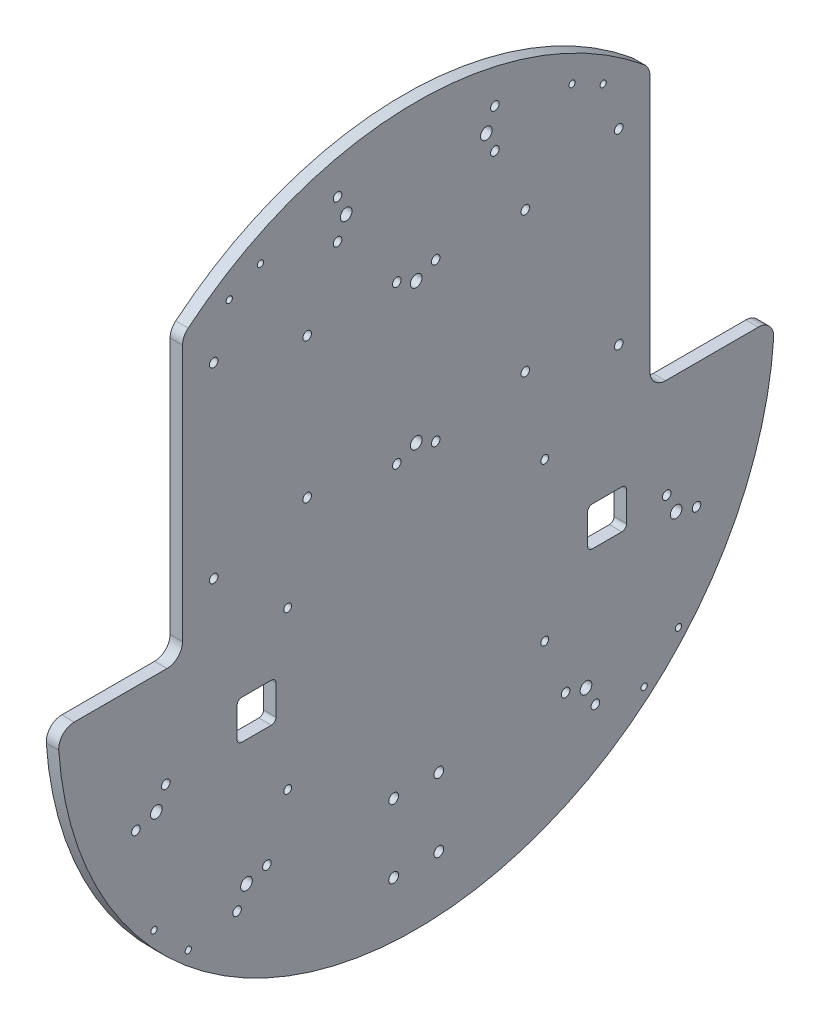
from build123d import *

# Parameters (mm, degrees)
SKETCH_1_R           = 230
EXTRUDE_1_DEPTH      = 8
SKETCH_2_W           = 80
SKETCH_2_H           = 200
CUT_EXTRUDE_1_DEPTH  = 12
SKETCH_3_R           = 2.75
CUT_EXTRUDE_2_DEPTH  = 12
SKETCH_4_R           = 3.15
CUT_EXTRUDE_3_DEPTH  = 12
SKETCH_5_R           = 3.75
SKETCH_5_R_2         = 2.75
CUT_EXTRUDE_4_DEPTH  = 10
FILLET_1_R           = 10
SKETCH_6_W           = 25
SKETCH_6_H           = 25
CUT_EXTRUDE_5_DEPTH  = 10
SKETCH_7_R           = 2.5
CUT_EXTRUDE_6_DEPTH  = 10
SKETCH_8_W           = 25
SKETCH_8_H           = 25
CUT_EXTRUDE_7_DEPTH  = 10
FILLET_3_R           = 3
SKETCH_10_R          = 2
CUT_EXTRUDE_9_DEPTH  = 326.005785815
SKETCH_11_R          = 2
CUT_EXTRUDE_10_DEPTH = 25
FILLET_4_R           = 3


with BuildPart() as part:
    # 草图1 → 凸台-拉伸1 (new body)
    with BuildSketch(Plane(origin=(0, 0, 0), x_dir=(0, 0, -1), z_dir=(1, 0, 0))):
        Circle(SKETCH_1_R)
    extrude(amount=EXTRUDE_1_DEPTH)

    # 草图2 → 切除-拉伸1 (cut)
    with BuildSketch(Plane(origin=(8, 0, 0), x_dir=(0, 0, -1), z_dir=(1, 0, 0))):
        with Locations((-190, 95)):
            Rectangle(SKETCH_2_W, SKETCH_2_H)
        with Locations((190, 95)):
            Rectangle(SKETCH_2_W, SKETCH_2_H)
    extrude(amount=-CUT_EXTRUDE_1_DEPTH, mode=Mode.SUBTRACT)

    # 草图3 → 切除-拉伸2 (cut)
    with BuildSketch(Plane(origin=(8, 0, 0), x_dir=(0, 0, -1), z_dir=(1, 0, 0))):
        with Locations((-130, 150)):
            Circle(SKETCH_3_R)
        with Locations((-130, 30)):
            Circle(SKETCH_3_R)
        with Locations((130, 30)):
            Circle(SKETCH_3_R)
        with Locations((130, 150)):
            Circle(SKETCH_3_R)
        with Locations((-70, 135)):
            Circle(SKETCH_3_R)
        with Locations((-70, 45)):
            Circle(SKETCH_3_R)
        with Locations((70, 135)):
            Circle(SKETCH_3_R)
        with Locations((70, 45)):
            Circle(SKETCH_3_R)
    extrude(amount=-CUT_EXTRUDE_2_DEPTH, mode=Mode.SUBTRACT)

    # 草图4 → 切除-拉伸3 (cut)
    with BuildSketch(Plane(origin=(8, 0, 0), x_dir=(0, 0, -1), z_dir=(1, 0, 0))):
        with Locations((-14.5, -150)):
            Circle(SKETCH_4_R)
        with Locations((14.5, -150)):
            Circle(SKETCH_4_R)
        with Locations((14.5, -194)):
            Circle(SKETCH_4_R)
        with Locations((-14.5, -194)):
            Circle(SKETCH_4_R)
    extrude(amount=-CUT_EXTRUDE_3_DEPTH, mode=Mode.SUBTRACT)

    # 草图5 → 切除-拉伸4 (cut)
    with BuildSketch(Plane(origin=(8, 0, 0), x_dir=(0, 0, -1), z_dir=(1, 0, 0))):
        with Locations((166.813442197, -81.229769803)):
            Circle(SKETCH_5_R)
        with Locations((108.962557326, -150.173769684)):
            Circle(SKETCH_5_R)
        with Locations((-108.962557326, -150.173769684)):
            Circle(SKETCH_5_R)
        with Locations((-166.813442197, -81.229769803)):
            Circle(SKETCH_5_R)
        with Locations((-45, 190)):
            Circle(SKETCH_5_R)
        with Locations((45, 190)):
            Circle(SKETCH_5_R)
        with Locations((-12.5, 35)):
            Circle(SKETCH_5_R_2)
        with Locations((12.5, 35)):
            Circle(SKETCH_5_R_2)
        with Locations((95.851669933, -146.352169)):
            Circle(SKETCH_5_R_2)
        with Locations((160.773218512, -68.981680245)):
            Circle(SKETCH_5_R_2)
        with Locations((179.92432959, -85.051370487)):
            Circle(SKETCH_5_R_2)
        with Locations((115.002781011, -162.421859242)):
            Circle(SKETCH_5_R_2)
        with Locations((-179.92432959, -85.051370487)):
            Circle(SKETCH_5_R_2)
        with Locations((-160.773218512, -68.981680245)):
            Circle(SKETCH_5_R_2)
        with Locations((-95.851669933, -146.352169)):
            Circle(SKETCH_5_R_2)
        with Locations((-115.002781011, -162.421859242)):
            Circle(SKETCH_5_R_2)
        with Locations((50.5, 202.5)):
            Circle(SKETCH_5_R_2)
        with Locations((-50.5, 202.5)):
            Circle(SKETCH_5_R_2)
        with Locations((50.5, 177.5)):
            Circle(SKETCH_5_R_2)
        with Locations((-50.5, 177.5)):
            Circle(SKETCH_5_R_2)
        with Locations((12.5, 136)):
            Circle(SKETCH_5_R_2)
        with Locations((-12.5, 136)):
            Circle(SKETCH_5_R_2)
        with Locations((0, 130.5)):
            Circle(SKETCH_5_R)
        with Locations((0, 40.5)):
            Circle(SKETCH_5_R)
    extrude(amount=-CUT_EXTRUDE_4_DEPTH, mode=Mode.SUBTRACT)

    # 圆角1
    fillet_1_edges = [part.edges().sort_by_distance(p)[0] for p in [
        (4, 174.355957742, -150),
        (4, -5, -150),
        (4, -5, -229.945645751),
        (4, 174.355957742, 150),
        (4, -5, 229.945645751),
        (4, -5, 150),
    ]]
    fillet(fillet_1_edges, radius=FILLET_1_R)

    # 草图6 → 切除-拉伸5 (cut)
    with BuildSketch(Plane(origin=(8, 0, 0), x_dir=(0, 0, -1), z_dir=(1, 0, 0))):
        with Locations((-102.5, -57.5)):
            Rectangle(SKETCH_6_W, SKETCH_6_H)
    extrude(amount=-CUT_EXTRUDE_5_DEPTH, mode=Mode.SUBTRACT)

    # 草图7 → 切除-拉伸6 (cut)
    with BuildSketch(Plane(origin=(8, 0, 0), x_dir=(0, 0, -1), z_dir=(1, 0, 0))):
        with Locations((82.5, -10)):
            Circle(SKETCH_7_R)
        with Locations((82.5, -111)):
            Circle(SKETCH_7_R)
        with Locations((-82.5, -10)):
            Circle(SKETCH_7_R)
        with Locations((-82.5, -111)):
            Circle(SKETCH_7_R)
    extrude(amount=-CUT_EXTRUDE_6_DEPTH, mode=Mode.SUBTRACT)

    # 草图8 → 切除-拉伸7 (cut)
    with BuildSketch(Plane(origin=(8, 0, 0), x_dir=(0, 0, -1), z_dir=(1, 0, 0))):
        with Locations((122.5, -62.5)):
            Rectangle(SKETCH_8_W, SKETCH_8_H)
    extrude(amount=-CUT_EXTRUDE_7_DEPTH, mode=Mode.SUBTRACT)

    # 圆角3
    fillet_3_edges = [part.edges().sort_by_distance(p)[0] for p in [
        (4, -75, -110),
        (4, -50, -110),
        (4, -50, -135),
        (4, -75, -135),
    ]]
    fillet(fillet_3_edges, radius=FILLET_3_R)

    # 草图10 → 切除-拉伸9 (cut, through all)
    with BuildSketch(Plane(origin=(8, 0, 0), x_dir=(0, 0, -1), z_dir=(1, 0, 0))):
        with Locations((168.30023639, -146.301163465)):
            Circle(SKETCH_10_R)
        with Locations((146.301163465, -168.30023639)):
            Circle(SKETCH_10_R)
        with Locations(Location((-146.301163465, -168.30023639, 0), (0, 0, 180))):
            Circle(SKETCH_10_R)
        with Locations(Location((-168.30023639, -146.301163465, 0), (0, 0, 180))):
            Circle(SKETCH_10_R)
    extrude(amount=-CUT_EXTRUDE_9_DEPTH, mode=Mode.SUBTRACT)

    # 草图11 → 切除-拉伸10 (cut)
    with BuildSketch(Plane(origin=(8, 0, 0), x_dir=(0, 0, -1), z_dir=(1, 0, 0))):
        with Locations((100, 190)):
            Circle(SKETCH_11_R)
        with Locations((120, 180)):
            Circle(SKETCH_11_R)
        with Locations((-120, 180)):
            Circle(SKETCH_11_R)
        with Locations((-100, 190)):
            Circle(SKETCH_11_R)
    extrude(amount=-CUT_EXTRUDE_10_DEPTH, mode=Mode.SUBTRACT)

    # 圆角4
    fillet_4_edges = [part.edges().sort_by_distance(p)[0] for p in [
        (4, -70, 115),
        (4, -45, 115),
        (4, -45, 90),
        (4, -70, 90),
    ]]
    fillet(fillet_4_edges, radius=FILLET_4_R)


solid = part.part
